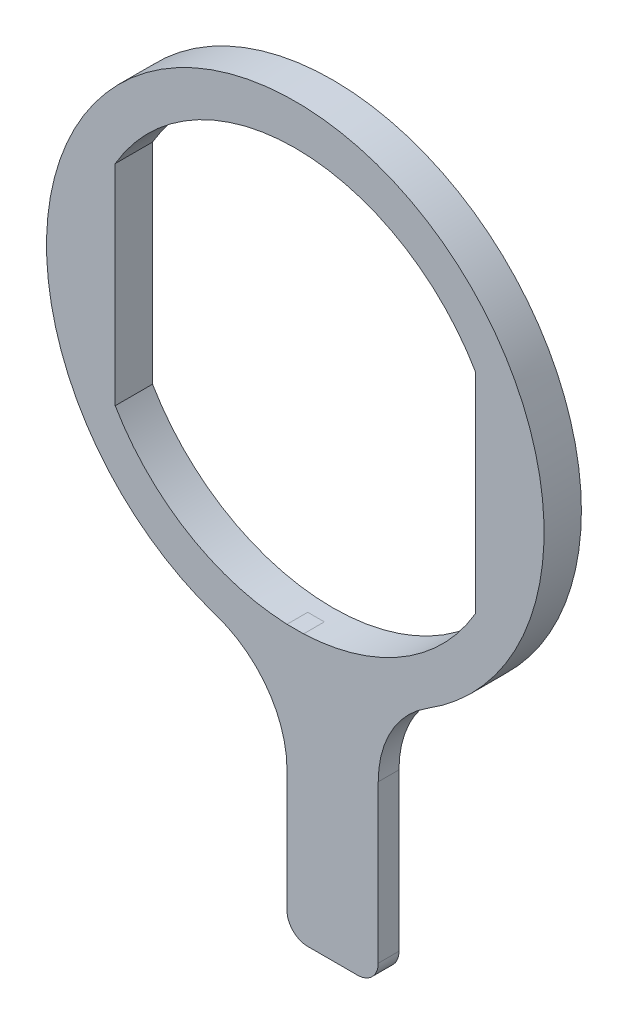
from build123d import *

# Parameters (mm, degrees)
SKIZZE1_R                       = 12
SKIZZE1_R_2                     = 10.05
AUFSATZ_LINEAR_AUSTRAGEN1_DEPTH = 1.8
SKIZZE2_W                       = 4.4
SKIZZE2_H                       = 12.957963354
AUFSATZ_LINEAR_AUSTRAGEN2_DEPTH = 1
VERRUNDUNG1_R                   = 5
VERRUNDUNG2_R                   = 1
AUFSATZ_LINEAR_AUSTRAGEN3_DEPTH = 1.8


with BuildPart() as part:
    # Skizze1 → Aufsatz-Linear austragen1 (new body)
    with BuildSketch(Plane.XY):
        Circle(SKIZZE1_R)
        Circle(SKIZZE1_R_2, mode=Mode.SUBTRACT)
    extrude(amount=AUFSATZ_LINEAR_AUSTRAGEN1_DEPTH)

    # Skizze2 → Aufsatz-Linear austragen2 (add)
    with BuildSketch(Plane.XY.offset(1.8)):
        with Locations((1.8, -16.521018323)):
            Rectangle(SKIZZE2_W, SKIZZE2_H)
    extrude(amount=-AUFSATZ_LINEAR_AUSTRAGEN2_DEPTH)

    # Verrundung1
    verrundung1_edges = [part.edges().sort_by_distance(p)[0] for p in [
        (-0.4, -11.99333148, 1.3),
        (4, -11.313708499, 1.3),
    ]]
    fillet(verrundung1_edges, radius=VERRUNDUNG1_R)

    # Verrundung2
    verrundung2_edges = [part.edges().sort_by_distance(p)[0] for p in [
        (-0.4, -23, 1.3),
        (4, -23, 1.3),
    ]]
    fillet(verrundung2_edges, radius=VERRUNDUNG2_R)

    # Skizze1<3> → Aufsatz-Linear austragen3 (add)
    with BuildSketch(Plane.XY):
        with BuildLine():
            Line((-8.685254038, -5.056566256), (-8.685254038, 5.056566256))
            ThreePointArc((-8.685254038, 5.056566256), (-10.05, 0), (-8.685254038, -5.056566256))
        make_face()
        with BuildLine():
            ThreePointArc((10.05, 0), (9.702816681, 2.618749408), (8.685254038, 5.056566256))
            Line((8.685254038, 5.056566256), (8.685254038, -5.056566256))
            ThreePointArc((8.685254038, -5.056566256), (9.702816681, -2.618749408), (10.05, 0))
        make_face()
    extrude(amount=AUFSATZ_LINEAR_AUSTRAGEN3_DEPTH)


solid = part.part
